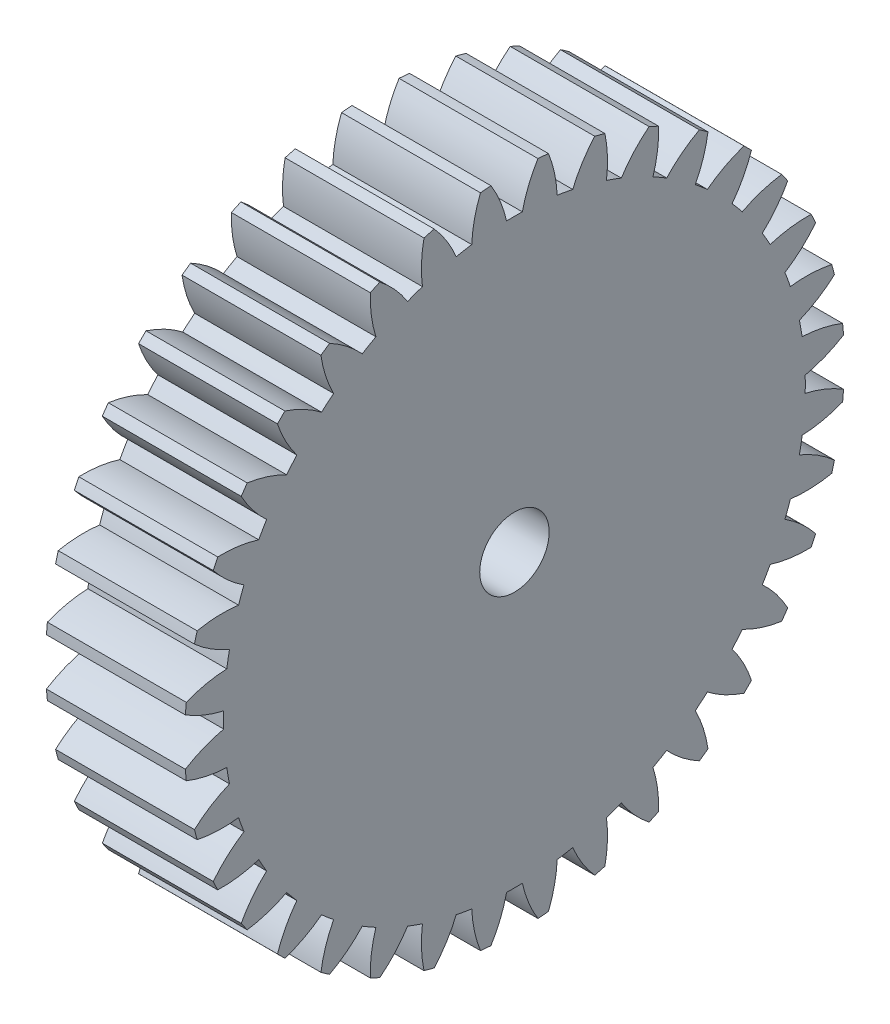
from build123d import *

# Parameters (mm, degrees)
BASPROSKE_W     = 8
BASPROSKE_H     = 19
TOOTHCUT_DEPTH  = 29.035691538
TEETHCUTS_COUNT = 36
TEETHCUTS_ANGLE = 350
BORSKE_R        = 2
BORE_DEPTH      = 50.0000508


with BuildPart() as part:
    # BasProSke → Base-Revolve (revolve)
    with BuildSketch(Plane(origin=(0, 0, 0), x_dir=(1, 0, 0), z_dir=(0, 1, 0)), mode=Mode.PRIVATE) as base_revolve_sk:
        with Locations((4, 9.5)):
            Rectangle(BASPROSKE_W, BASPROSKE_H)
    revolve(base_revolve_sk.sketch.rotate(Axis((-10, 0, 0), (1, 0, 0)), 180), axis=Axis((-10, 0, 0), (1, 0, 0)))

    # TooCutSke → ToothCut (cut, through all)
    with BuildSketch(Plane(origin=(0, 0, 0), x_dir=(0, 0, -1), z_dir=(1, 0, 0))):
        with BuildLine():
            ThreePointArc((0.454664826, 16.742827745), (0, 16.749), (-0.454664826, 16.742827745))
            ThreePointArc((-0.454664826, 16.742827745), (-0.817558311, 17.898033097), (-1.368909141, 18.976088452))
            ThreePointArc((-1.368909141, 18.976088452), (0, 19.0254), (1.368909141, 18.976088452))
            ThreePointArc((1.368909141, 18.976088452), (0.817558311, 17.898033097), (0.454664826, 16.742827745))
        make_face()
    toothcut = extrude(amount=TOOTHCUT_DEPTH, mode=Mode.SUBTRACT)

    # TeethCuts: ToothCut ×36 about axis
    teethcuts_axis = Axis((-10, 0, 0), (1, 0, 0))
    for i in range(1, TEETHCUTS_COUNT):
        add(toothcut.rotate(teethcuts_axis, i * TEETHCUTS_ANGLE / (TEETHCUTS_COUNT - 1)), mode=Mode.SUBTRACT)

    # BorSke → Bore (cut, symmetric)
    with BuildSketch(Plane(origin=(0, 0, 0), x_dir=(0, 0, -1), z_dir=(1, 0, 0))):
        with Locations(Location((0, 0, 0), (0, 0, 180))):
            Circle(BORSKE_R)
    extrude(amount=BORE_DEPTH, both=True, mode=Mode.SUBTRACT)


solid = part.part
